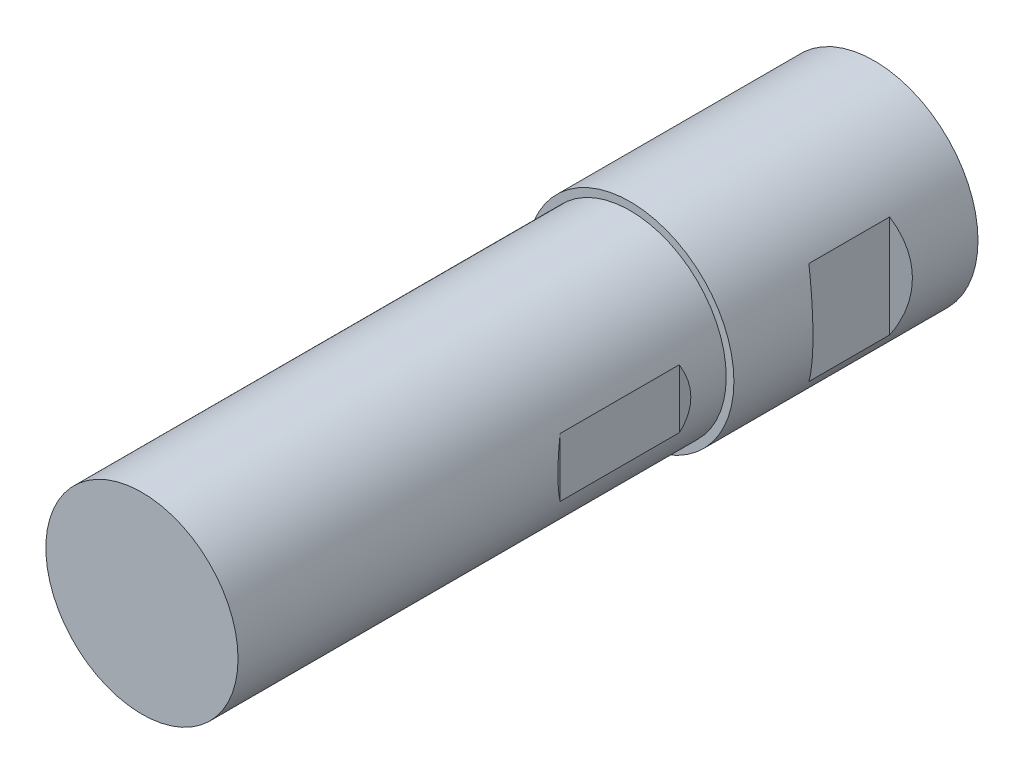
from build123d import *

# Parameters (mm, degrees)
SKETCH1_R               = 27
BOSS_EXTRUDE1_DEPTH     = 63.5
SKETCH2_R               = 25
BOSS_EXTRUDE2_DEPTH     = 127
CUT_EXTRUDE1_DEPTH      = 195.289088731
CUT_EXTRUDE1_DEPTH_BACK = 195.289088731


with BuildPart() as part:
    # Sketch1 → Boss-Extrude1 (new body)
    with BuildSketch(Plane.XY):
        Circle(SKETCH1_R)
    extrude(amount=BOSS_EXTRUDE1_DEPTH)

    # Sketch2 → Boss-Extrude2 (add)
    with BuildSketch(Plane.XY.offset(63.5)):
        Circle(SKETCH2_R)
    extrude(amount=BOSS_EXTRUDE2_DEPTH)

    # Sketch4 → Cut-Extrude1 (cut, two sides: drawn at the far end of the back side and taken through both)
    with BuildSketch(Plane(origin=(0, 0, 0), x_dir=(1, 0, 0), z_dir=(0, 1, 0)).offset(-CUT_EXTRUDE1_DEPTH_BACK)):
        Polygon((-25, -72.711167147), (-23.8, -74.5), (-23.8, -105.5), (-25, -107.288832853), align=None)
        Polygon((-27.757940887, -16.532917761), (-27.757940887, -43.467082239), (-23.5, -40.5), (-23.5, -19.5), align=None)
        Polygon((23.8, -74.5), (23.8, -105.5), (25, -107.288832853), (25, -72.711167147), align=None)
        Polygon((27.757940887, -16.532917761), (27.757940887, -43.467082239), (23.5, -40.5), (23.5, -19.5), align=None)
    extrude(amount=CUT_EXTRUDE1_DEPTH + CUT_EXTRUDE1_DEPTH_BACK, mode=Mode.SUBTRACT)


solid = part.part
